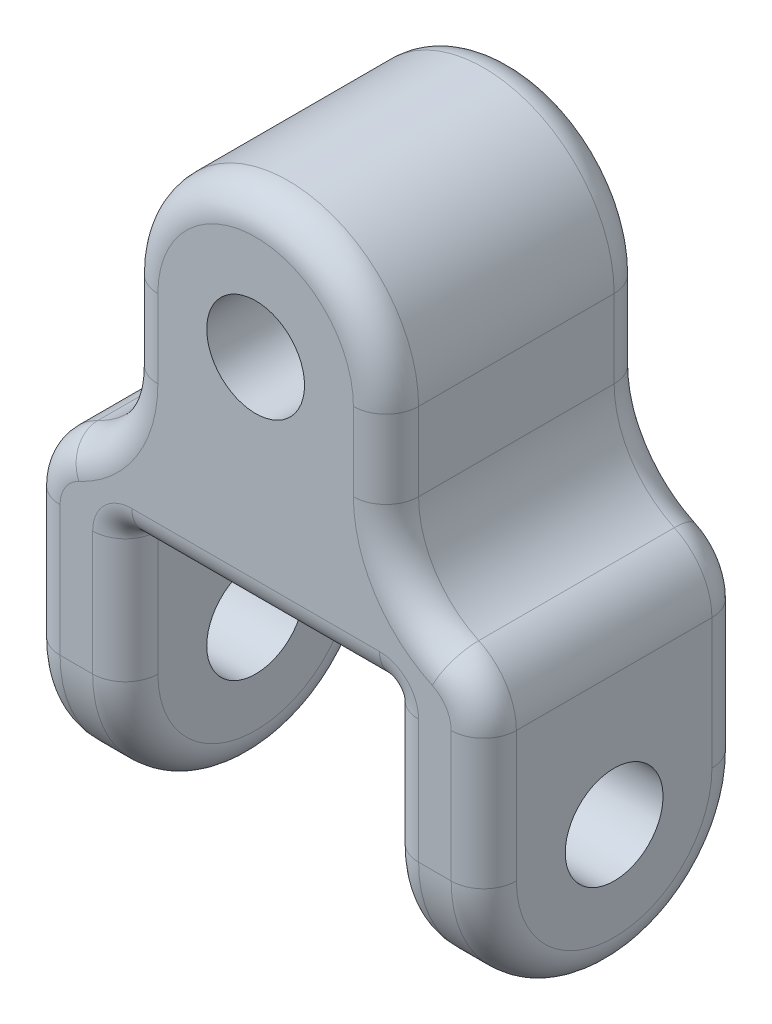
from build123d import *

# Parameters (mm, degrees)
BOSS_EXTRUDE1_DEPTH = 40
FILLET2_RADIUS      = 20
FILLET2_LENGTH      = 15
FILLET3_RADIUS      = 20
FILLET3_LENGTH      = 15
SKETCH2_R           = 7.5
CUT_EXTRUDE1_DEPTH  = 126.025657643
SKETCH3_R           = 7.5
CUT_EXTRUDE2_DEPTH  = 40
FILLET5_R           = 1
FILLET6_R           = 5


with BuildPart() as part:
    # Sketch1 → Boss-Extrude1 (new body)
    with BuildSketch(Plane.XY):
        with BuildLine():
            Line((-20, 40), (-20, 0))
            Line((-20, 0), (-35, 0))
            Line((-35, 0), (-35, 40))
            ThreePointArc((-35, 40), (-33.435273923, 45.370861555), (-29.230769231, 49.060937684))
            ThreePointArc((-29.230769231, 49.060937684), (-22.503561723, 54.96505949), (-20, 63.558437979))
            Line((-20, 63.558437979), (-20, 75.558437979))
            ThreePointArc((-20, 75.558437979), (0, 95.558437979), (20, 75.558437979))
            Line((20, 75.558437979), (20, 63.558437979))
            ThreePointArc((20, 63.558437979), (22.503561723, 54.96505949), (29.230769231, 49.060937684))
            ThreePointArc((29.230769231, 49.060937684), (33.435273923, 45.370861555), (35, 40))
            Line((35, 40), (35, 0))
            Line((35, 0), (20, 0))
            Line((20, 0), (20, 40))
            Line((20, 40), (-20, 40))
        make_face()
    extrude(amount=BOSS_EXTRUDE1_DEPTH)

    # Fillet2: full round fillet: the end face becomes a half cylinder, R = half its width
    fillet2_face = Plane((27.5, 0, 20), x_dir=(-1, 0, 0), z_dir=(0, -1, 0))  # on the end face: x along it, z out of the body
    fillet2_slab = fillet2_face.offset(-FILLET2_RADIUS / 2) * Box(FILLET2_LENGTH, 2 * FILLET2_RADIUS, FILLET2_RADIUS, mode=Mode.PRIVATE)  # the body's end, R deep
    fillet2_round = Plane((27.5, 20, 20), x_dir=(0, -1, 0), z_dir=(-1, 0, 0)) * Cylinder(FILLET2_RADIUS, FILLET2_LENGTH, mode=Mode.PRIVATE)  # its axis R under the face
    add(fillet2_slab - fillet2_round, mode=Mode.SUBTRACT)

    # Fillet3: full round fillet: the end face becomes a half cylinder, R = half its width
    fillet3_face = Plane((-27.5, 0, 20), x_dir=(1, 0, 0), z_dir=(0, -1, 0))  # on the end face: x along it, z out of the body
    fillet3_slab = fillet3_face.offset(-FILLET3_RADIUS / 2) * Box(FILLET3_LENGTH, 2 * FILLET3_RADIUS, FILLET3_RADIUS, mode=Mode.PRIVATE)  # the body's end, R deep
    fillet3_round = Plane((-27.5, 20, 20), x_dir=(0, -1, 0), z_dir=(1, 0, 0)) * Cylinder(FILLET3_RADIUS, FILLET3_LENGTH, mode=Mode.PRIVATE)  # its axis R under the face
    add(fillet3_slab - fillet3_round, mode=Mode.SUBTRACT)

    # Sketch2 → Cut-Extrude1 (cut, through all)
    with BuildSketch(Plane.ZY.offset(35)):
        with Locations((20, 20)):
            Circle(SKETCH2_R)
    extrude(amount=-CUT_EXTRUDE1_DEPTH, mode=Mode.SUBTRACT)

    # Sketch3 → Cut-Extrude2 (cut)
    with BuildSketch(Plane.XY.offset(40)):
        with Locations((0, 74.60245825)):
            Circle(SKETCH3_R)
    extrude(amount=-CUT_EXTRUDE2_DEPTH, mode=Mode.SUBTRACT)

    # Fillet5
    fillet5_edges = [part.edges().sort_by_distance(p)[0] for p in [
        (-20, 40, 20),
        (20, 40, 20),
    ]]
    fillet(fillet5_edges, radius=FILLET5_R)

    # Fillet6
    fillet6_edges = [part.edges().sort_by_distance(p)[0] for p in [
        (-35, 30, 0),
        (-33.435273923, 45.370861555, 0),
        (-22.503561723, 54.96505949, 0),
        (-20, 69.558437979, 0),
        (0, 95.558437979, 0),
        (20, 69.558437979, 0),
        (22.503561723, 54.96505949, 0),
        (33.435273923, 45.370861555, 0),
        (33.435273923, 45.370861555, 40),
        (22.503561723, 54.96505949, 40),
        (20, 69.558437979, 40),
        (0, 95.558437979, 40),
        (-20, 69.558437979, 40),
        (35, 30, 40),
        (35, 30, 0),
        (-22.503561723, 54.96505949, 40),
        (20, 0, 20),
        (35, 0, 20),
        (-33.435273923, 45.370861555, 40),
        (-20, 29.5, 40),
        (-20, 29.5, 0),
        (-35, 0, 20),
        (-35, 30, 40),
        (-20, 0, 20),
        (0, 40, 0),
        (0, 40, 40),
        (20, 29.5, 0),
        (20, 29.5, 40),
        (-19.707106781, 39.707106781, 0),
        (-19.707106781, 39.707106781, 40),
        (19.707106781, 39.707106781, 0),
        (19.707106781, 39.707106781, 40),
    ]]
    fillet(fillet6_edges, radius=FILLET6_R)


solid = part.part
